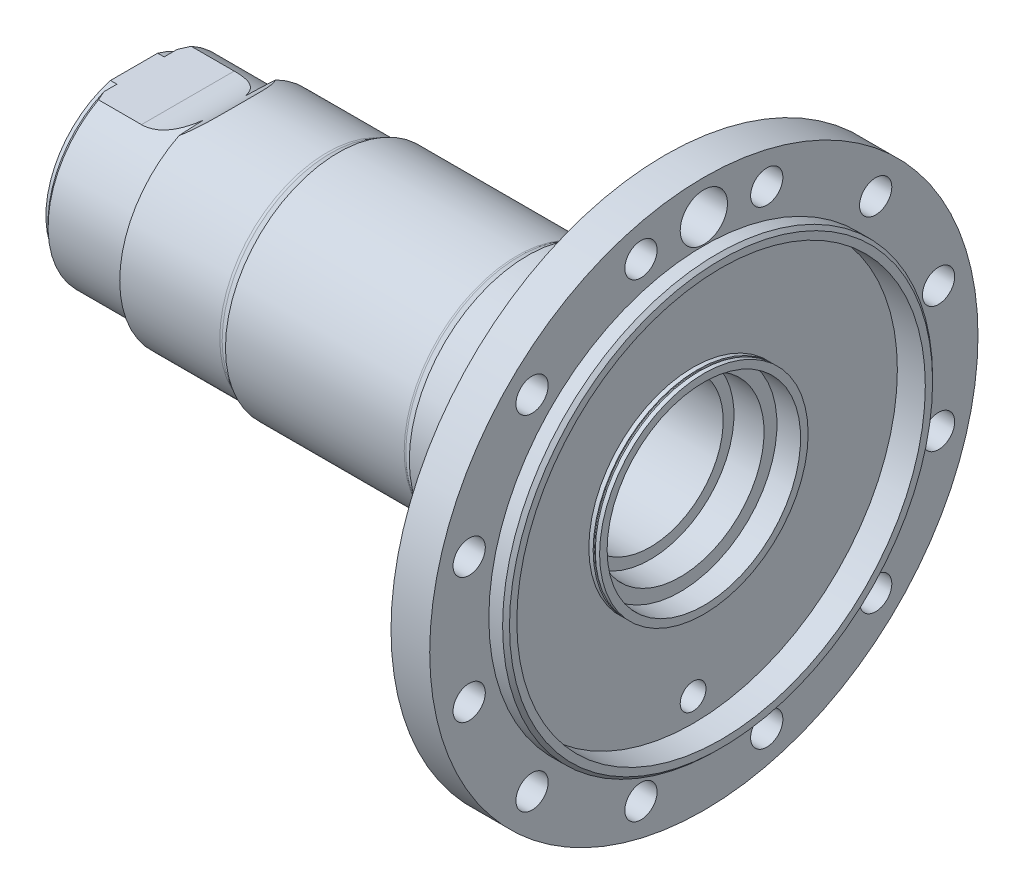
from build123d import *

# Parameters (mm, degrees)
SKETCH_3_W                    = 2
SKETCH_3_H                    = 46.5
SKETCH_5_W                    = 2
SKETCH_5_H                    = 46.5
SKETCH_6_R                    = 7.5
CUT_EXTRUDE_1_DEPTH           = 328.171973127
SKETCH_7_R                    = 7.5
CUT_EXTRUDE_2_DEPTH           = 328.171973127
SKETCH_8_R                    = 7.5
CUT_EXTRUDE_3_DEPTH           = 328.171973127
SKETCH_9_R                    = 7.5
CUT_EXTRUDE_4_DEPTH           = 328.171973127
SKETCH_10_R                   = 7.5
CUT_EXTRUDE_5_DEPTH           = 328.171973127
SKETCH_11_R                   = 7.5
CUT_EXTRUDE_6_DEPTH           = 328.171973127
SKETCH_12_R                   = 7.5
CUT_EXTRUDE_7_DEPTH           = 328.171973127
SKETCH_13_R                   = 7.5
CUT_EXTRUDE_8_DEPTH           = 328.171973127
SKETCH_14_R                   = 7.5
CUT_EXTRUDE_9_DEPTH           = 328.171973127
SKETCH_15_R                   = 7.5
CUT_EXTRUDE_10_DEPTH          = 328.171973127
SKETCH_16_R                   = 7.5
CUT_EXTRUDE_11_DEPTH          = 328.171973127
SKETCH_17_R                   = 7.5
CUT_EXTRUDE_12_DEPTH          = 328.171973127
SKETCH_18_R                   = 11
CUT_EXTRUDE_13_DEPTH          = 328.171973127
SKETCH_19_R                   = 6
CUT_EXTRUDE_14_DEPTH          = 328.171973127
LEFT_FLAT_84_5_R35_DEPTH      = 328.171973127
LEFT_FLAT_84_5_R35_DEPTH_BACK = 328.171973127
LEFT_END_BOTTOM_20_DEPTH      = 328.171973127
LEFT_END_BOTTOM_20_DEPTH_BACK = 328.171973127
SKETCH_21_W                   = 4
SKETCH_21_H                   = 75


with BuildPart() as part:
    # Эскиз1 → Повернуть1 (revolve)
    with BuildSketch(Plane.XY, mode=Mode.PRIVATE) as revolve_1_sk:
        with BuildLine():
            Line((0, 0), (273, 0))
            Line((273, 0), (273, 98.4))
            Line((273, 98.4), (271.4, 100))
            Line((271.4, 100), (265, 100))
            Line((265, 100), (265, 127.5))
            Line((265, 127.5), (247, 127.5))
            Line((247, 127.5), (247, 94.828427125))
            ThreePointArc((247, 94.828427125), (246.847759065, 94.06306026), (246.414213562, 93.414213562))
            Line((246.414213562, 93.414213562), (245, 92))
            Line((245, 92), (245, 82.828427125))
            ThreePointArc((245, 82.828427125), (244.847759065, 82.06306026), (244.414213562, 81.414213562))
            Line((244.414213562, 81.414213562), (241, 78))
            Line((241, 78), (241, 68.328427125))
            ThreePointArc((241, 68.328427125), (240.847759065, 67.56306026), (240.414213562, 66.914213562))
            Line((240.414213562, 66.914213562), (239, 65.5))
            Line((239, 65.5), (239, 64.5))
            ThreePointArc((239, 64.5), (238.414213562, 63.085786438), (237, 62.5))
            Line((237, 62.5), (218, 62.5))
            Line((218, 62.5), (215, 60.767949192))
            Line((215, 60.767949192), (215, 57))
            ThreePointArc((215, 57), (214.414213562, 55.585786438), (213, 55))
            Line((213, 55), (183, 55))
            Line((183, 55), (179.133974596, 52.767949192))
            ThreePointArc((179.133974596, 52.767949192), (178.651612686, 52.568148347), (178.133974596, 52.5))
            Line((178.133974596, 52.5), (95, 52.5))
            Line((95, 52.5), (91.366025404, 50.401923789))
            ThreePointArc((91.366025404, 50.401923789), (90.642482539, 50.102222521), (89.866025404, 50))
            Line((89.866025404, 50), (43.339745962, 50))
            Line((43.339745962, 50), (42, 45))
            Line((42, 45), (5, 45))
            Line((5, 45), (3, 43))
            Line((3, 43), (3, 41))
            Line((3, 41), (0, 41))
            Line((0, 41), (0, 0))
        make_face()
    revolve(revolve_1_sk.sketch.rotate(Axis((0, 0, 0), (1, 0, 0)), 90), axis=Axis((0, 0, 0), (1, 0, 0)))

    # Эскиз2 → Вырез-Повернуть1 (revolve, cut)
    with BuildSketch(Plane.XY, mode=Mode.PRIVATE) as cut_revolve_1_sk:
        Polygon((0, 0), (273, 0), (273, 95), (265, 95), (265, 45), (254, 45), (254, 39), (240, 39), (240, 34), (203.5, 34), (203.5, 31), (3, 31), (0, 32.732050808), align=None)
    revolve(cut_revolve_1_sk.sketch.rotate(Axis((0, 0, 0), (1, 0, 0)), 90), axis=Axis((0, 0, 0), (1, 0, 0)), mode=Mode.SUBTRACT)

    # Эскиз3 → Rear_recess_left (revolve, cut)
    with BuildSketch(Plane.XY, mode=Mode.PRIVATE) as rear_recess_left_sk:
        with Locations((261, 71.75)):
            Rectangle(SKETCH_3_W, SKETCH_3_H)
    revolve(rear_recess_left_sk.sketch.rotate(Axis((0, 0, 0), (1, 0, 0)), 90), axis=Axis((0, 0, 0), (1, 0, 0)), mode=Mode.SUBTRACT)

    # Эскиз4 → Collar_groove_nominal (revolve, cut)
    with BuildSketch(Plane.XY, mode=Mode.PRIVATE) as collar_groove_nominal_sk:
        with BuildLine():
            Line((263, 48), (263, 95))
            Line((263, 95), (262, 95))
            Line((262, 95), (262, 48))
            ThreePointArc((262, 48), (262.146446609, 47.646446609), (262.5, 47.5))
            ThreePointArc((262.5, 47.5), (262.853553391, 47.646446609), (263, 48))
        make_face()
    revolve(collar_groove_nominal_sk.sketch.rotate(Axis((0, 0, 0), (1, 0, 0)), 90), axis=Axis((0, 0, 0), (1, 0, 0)), mode=Mode.SUBTRACT)

    # Эскиз5 → Rear_recess_lip (revolve, cut)
    with BuildSketch(Plane.XY, mode=Mode.PRIVATE) as rear_recess_lip_sk:
        with Locations((264, 71.75)):
            Rectangle(SKETCH_5_W, SKETCH_5_H)
    revolve(rear_recess_lip_sk.sketch.rotate(Axis((0, 0, 0), (1, 0, 0)), 90), axis=Axis((0, 0, 0), (1, 0, 0)), mode=Mode.SUBTRACT)

    # Эскиз6 → Вырез-Вытянуть1 (cut, through all)
    with BuildSketch(Plane(origin=(0, 0, 0), x_dir=(0, 0, -1), z_dir=(1, 0, 0))):
        with Locations(Location((109.149618371, 29.246552097, 0), (0, 0, 180))):
            Circle(SKETCH_6_R)
    extrude(amount=CUT_EXTRUDE_1_DEPTH, mode=Mode.SUBTRACT)

    # Эскиз7 → Вырез-Вытянуть2 (cut, through all)
    with BuildSketch(Plane(origin=(0, 0, 0), x_dir=(0, 0, -1), z_dir=(1, 0, 0))):
        with Locations(Location((79.903066274, 79.903066274, 0), (0, 0, 180))):
            Circle(SKETCH_7_R)
    extrude(amount=CUT_EXTRUDE_2_DEPTH, mode=Mode.SUBTRACT)

    # Эскиз8 → Вырез-Вытянуть3 (cut, through all)
    with BuildSketch(Plane(origin=(0, 0, 0), x_dir=(0, 0, -1), z_dir=(1, 0, 0))):
        with Locations(Location((29.246552097, 109.149618371, 0), (0, 0, 180))):
            Circle(SKETCH_8_R)
    extrude(amount=CUT_EXTRUDE_3_DEPTH, mode=Mode.SUBTRACT)

    # Эскиз9 → Вырез-Вытянуть4 (cut, through all)
    with BuildSketch(Plane(origin=(0, 0, 0), x_dir=(0, 0, -1), z_dir=(1, 0, 0))):
        with Locations(Location((-29.246552097, 109.149618371, 0), (0, 0, 180))):
            Circle(SKETCH_9_R)
    extrude(amount=CUT_EXTRUDE_4_DEPTH, mode=Mode.SUBTRACT)

    # Эскиз10 → Вырез-Вытянуть5 (cut, through all)
    with BuildSketch(Plane(origin=(0, 0, 0), x_dir=(0, 0, -1), z_dir=(1, 0, 0))):
        with Locations(Location((-79.903066274, 79.903066274, 0), (0, 0, 180))):
            Circle(SKETCH_10_R)
    extrude(amount=CUT_EXTRUDE_5_DEPTH, mode=Mode.SUBTRACT)

    # Эскиз11 → Вырез-Вытянуть6 (cut, through all)
    with BuildSketch(Plane(origin=(0, 0, 0), x_dir=(0, 0, -1), z_dir=(1, 0, 0))):
        with Locations(Location((-109.149618371, 29.246552097, 0), (0, 0, 180))):
            Circle(SKETCH_11_R)
    extrude(amount=CUT_EXTRUDE_6_DEPTH, mode=Mode.SUBTRACT)

    # Эскиз12 → Вырез-Вытянуть7 (cut, through all)
    with BuildSketch(Plane(origin=(0, 0, 0), x_dir=(0, 0, -1), z_dir=(1, 0, 0))):
        with Locations(Location((-109.149618371, -29.246552097, 0), (0, 0, 180))):
            Circle(SKETCH_12_R)
    extrude(amount=CUT_EXTRUDE_7_DEPTH, mode=Mode.SUBTRACT)

    # Эскиз13 → Вырез-Вытянуть8 (cut, through all)
    with BuildSketch(Plane(origin=(0, 0, 0), x_dir=(0, 0, -1), z_dir=(1, 0, 0))):
        with Locations(Location((-79.903066274, -79.903066274, 0), (0, 0, 180))):
            Circle(SKETCH_13_R)
    extrude(amount=CUT_EXTRUDE_8_DEPTH, mode=Mode.SUBTRACT)

    # Эскиз14 → Вырез-Вытянуть9 (cut, through all)
    with BuildSketch(Plane(origin=(0, 0, 0), x_dir=(0, 0, -1), z_dir=(1, 0, 0))):
        with Locations(Location((-29.246552097, -109.149618371, 0), (0, 0, 180))):
            Circle(SKETCH_14_R)
    extrude(amount=CUT_EXTRUDE_9_DEPTH, mode=Mode.SUBTRACT)

    # Эскиз15 → Вырез-Вытянуть10 (cut, through all)
    with BuildSketch(Plane(origin=(0, 0, 0), x_dir=(0, 0, -1), z_dir=(1, 0, 0))):
        with Locations(Location((29.246552097, -109.149618371, 0), (0, 0, 180))):
            Circle(SKETCH_15_R)
    extrude(amount=CUT_EXTRUDE_10_DEPTH, mode=Mode.SUBTRACT)

    # Эскиз16 → Вырез-Вытянуть11 (cut, through all)
    with BuildSketch(Plane(origin=(0, 0, 0), x_dir=(0, 0, -1), z_dir=(1, 0, 0))):
        with Locations(Location((79.903066274, -79.903066274, 0), (0, 0, 180))):
            Circle(SKETCH_16_R)
    extrude(amount=CUT_EXTRUDE_11_DEPTH, mode=Mode.SUBTRACT)

    # Эскиз17 → Вырез-Вытянуть12 (cut, through all)
    with BuildSketch(Plane(origin=(0, 0, 0), x_dir=(0, 0, -1), z_dir=(1, 0, 0))):
        with Locations(Location((109.149618371, -29.246552097, 0), (0, 0, 180))):
            Circle(SKETCH_17_R)
    extrude(amount=CUT_EXTRUDE_12_DEPTH, mode=Mode.SUBTRACT)

    # Эскиз18 → Вырез-Вытянуть13 (cut, through all)
    with BuildSketch(Plane(origin=(0, 0, 0), x_dir=(0, 0, -1), z_dir=(1, 0, 0))):
        with Locations(Location((0, 111.5, 0), (0, 0, 180))):
            Circle(SKETCH_18_R)
    extrude(amount=CUT_EXTRUDE_13_DEPTH, mode=Mode.SUBTRACT)

    # Эскиз19 → Вырез-Вытянуть14 (cut, through all)
    with BuildSketch(Plane(origin=(0, 0, 0), x_dir=(0, 0, -1), z_dir=(1, 0, 0))):
        with Locations(Location((0, -84, 0), (0, 0, 166.725608927))):
            Circle(SKETCH_19_R)
    extrude(amount=CUT_EXTRUDE_14_DEPTH, mode=Mode.SUBTRACT)

    # Эскиз20 → Left_flat_84_5_R35 (cut, two sides: drawn at the far end of the back side and taken through both)
    with BuildSketch(Plane.XY.offset(-LEFT_FLAT_84_5_R35_DEPTH_BACK)):
        with BuildLine():
            Line((-1, 39.5), (25, 39.5))
            ThreePointArc((25, 39.5), (49.748737342, 49.751262658), (60, 74.5))
            Line((60, 74.5), (60, 150))
            Line((60, 150), (-1, 150))
            Line((-1, 150), (-1, 39.5))
        make_face()
    extrude(amount=LEFT_FLAT_84_5_R35_DEPTH + LEFT_FLAT_84_5_R35_DEPTH_BACK, mode=Mode.SUBTRACT)

    # Эскиз21 → Left_end_bottom_20 (cut, two sides: drawn at the far end of the back side and taken through both)
    with BuildSketch(Plane.XY.offset(-LEFT_END_BOTTOM_20_DEPTH_BACK)):
        with Locations((1, -62.5)):
            Rectangle(SKETCH_21_W, SKETCH_21_H)
    extrude(amount=LEFT_END_BOTTOM_20_DEPTH + LEFT_END_BOTTOM_20_DEPTH_BACK, mode=Mode.SUBTRACT)


solid = part.part
